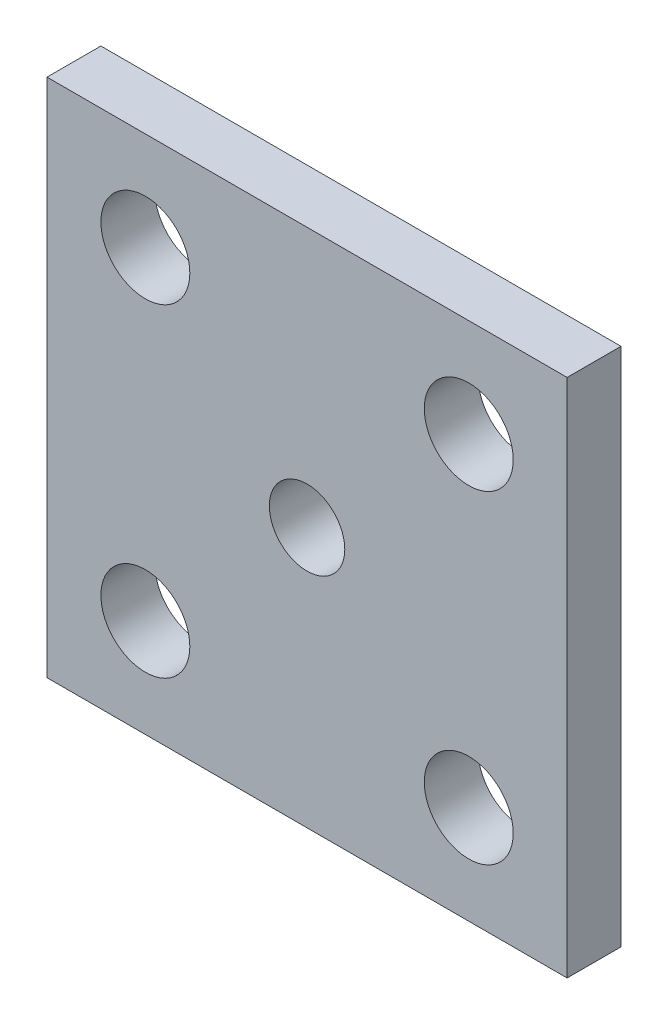
from build123d import *

# Parameters (mm, degrees)
SKETCH1_W           = 48.25
SKETCH1_H           = 48.25
SKETCH1_R           = 3.5
SKETCH1_R_2         = 4.125
BOSS_EXTRUDE1_DEPTH = 5


with BuildPart() as part:
    # Sketch1 → Boss-Extrude1 (new body)
    # profile 1 of 5: a face of its own
    with BuildSketch(Plane.XY):
        with Locations((24.125, 24.125)):
            Rectangle(SKETCH1_W, SKETCH1_H)
        with Locations((24.125, 24.125)):
            Circle(SKETCH1_R, mode=Mode.SUBTRACT)
        Polygon((34.895909278, 1.8), (30.666818556, 9.125), (34.895909278, 16.45), (43.354090722, 16.45), (47.583181444, 9.125), (43.354090722, 1.8), align=None, mode=Mode.SUBTRACT)
        Polygon((13.354090722, 1.8), (17.583181444, 9.125), (13.354090722, 16.45), (4.895909278, 16.45), (0.666818556, 9.125), (4.895909278, 1.8), align=None, mode=Mode.SUBTRACT)
        Polygon((34.895909278, 31.8), (43.354090722, 31.8), (47.583181444, 39.125), (43.354090722, 46.45), (34.895909278, 46.45), (30.666818556, 39.125), align=None, mode=Mode.SUBTRACT)
        Polygon((17.583181444, 39.125), (13.354090722, 31.8), (4.895909278, 31.8), (0.666818556, 39.125), (4.895909278, 46.45), (13.354090722, 46.45), align=None, mode=Mode.SUBTRACT)
    # profile 2 of 5: a face of its own
    with BuildSketch(Plane.XY):
        Polygon((30.666818556, 39.125), (34.895909278, 31.8), (43.354090722, 31.8), (47.583181444, 39.125), (43.354090722, 46.45), (34.895909278, 46.45), align=None)
        with Locations((39.125, 39.125)):
            Circle(SKETCH1_R_2, mode=Mode.SUBTRACT)
    # profile 3 of 5: a face of its own
    with BuildSketch(Plane.XY):
        Polygon((30.666818556, 9.125), (34.895909278, 16.45), (43.354090722, 16.45), (47.583181444, 9.125), (43.354090722, 1.8), (34.895909278, 1.8), align=None)
        with Locations((39.125, 9.125)):
            Circle(SKETCH1_R_2, mode=Mode.SUBTRACT)
    # profile 4 of 5: a face of its own
    with BuildSketch(Plane.XY):
        Polygon((4.895909278, 1.8), (13.354090722, 1.8), (17.583181444, 9.125), (13.354090722, 16.45), (4.895909278, 16.45), (0.666818556, 9.125), align=None)
        with Locations((9.125, 9.125)):
            Circle(SKETCH1_R_2, mode=Mode.SUBTRACT)
    # profile 5 of 5: a face of its own
    with BuildSketch(Plane.XY):
        Polygon((13.354090722, 31.8), (4.895909278, 31.8), (0.666818556, 39.125), (4.895909278, 46.45), (13.354090722, 46.45), (17.583181444, 39.125), align=None)
        with Locations((9.125, 39.125)):
            Circle(SKETCH1_R_2, mode=Mode.SUBTRACT)
    extrude(amount=BOSS_EXTRUDE1_DEPTH)


solid = part.part
